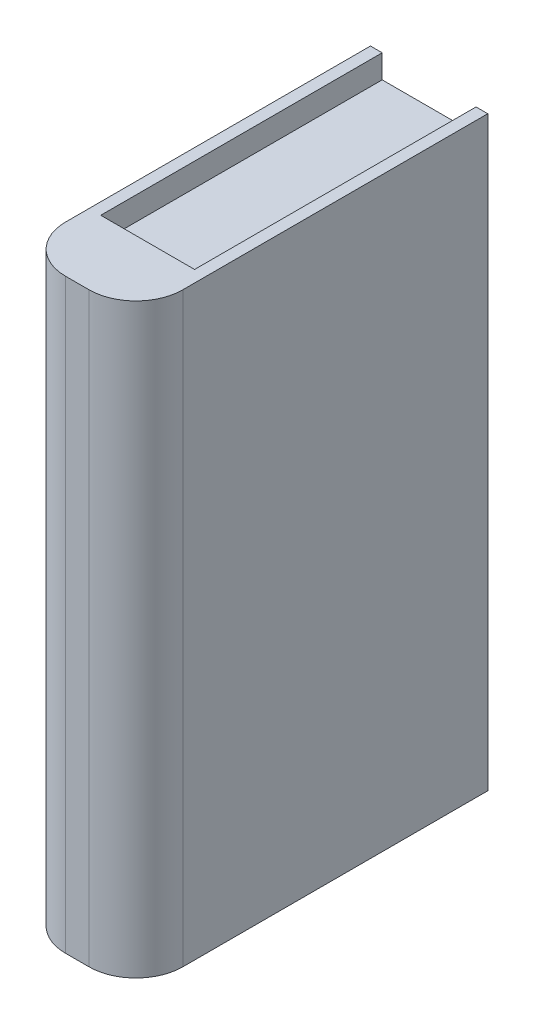
from build123d import *

# Parameters (mm, degrees)
SKETCH1_W           = 15
SKETCH1_H           = 25
BOSS_EXTRUDE1_DEPTH = 5
FILLET1_R           = 2
SKETCH2_W           = 4
SKETCH2_H           = 12
CUT_EXTRUDE1_DEPTH  = 1


with BuildPart() as part:
    # Sketch1 → Boss-Extrude1 (new body)
    with BuildSketch(Plane(origin=(0, 0, 0), x_dir=(0, 0, -1), z_dir=(1, 0, 0))):
        with Locations((-7.5, 12.5)):
            Rectangle(SKETCH1_W, SKETCH1_H)
    extrude(amount=BOSS_EXTRUDE1_DEPTH)

    # Fillet1
    fillet1_edges = [part.edges().sort_by_distance(p)[0] for p in [
        (5, 12.5, 15),
        (0, 12.5, 15),
    ]]
    fillet(fillet1_edges, radius=FILLET1_R)

    # Sketch2 → Cut-Extrude1 (cut)
    with BuildSketch(Plane(origin=(0, 25, 0), x_dir=(1, 0, 0), z_dir=(0, 1, 0))):
        with Locations((2.5, -6)):
            Rectangle(SKETCH2_W, SKETCH2_H)
    extrude(amount=-CUT_EXTRUDE1_DEPTH, mode=Mode.SUBTRACT)


solid = part.part
